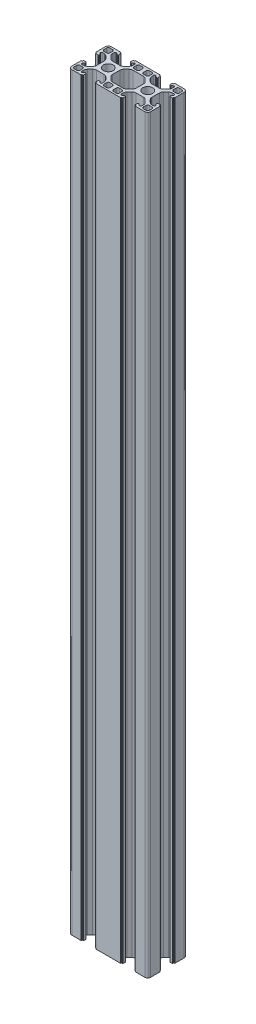
from build123d import *

# Parameters (mm, degrees)
EXTRUDE_1_DEPTH = 380


with BuildPart() as part:
    # Эскиз1 → Бобышка-Вытянуть1 (new body)
    with BuildSketch(Plane(origin=(0, 0, 0), x_dir=(1, 0, 0), z_dir=(0, 1, 0))):
        with BuildLine():
            Line((9.247825015, 4.683728486), (11.146605684, 4.683728486))
            ThreePointArc((11.146605684, 4.683728486), (11.911972549, 4.835969421), (12.560819246, 5.269514923))
            Line((12.560819246, 5.269514923), (13.862038577, 6.570734254))
            ThreePointArc((13.862038577, 6.570734254), (14.29558408, 7.219580952), (14.447825015, 7.984947817))
            Line((14.447825015, 7.984947817), (14.447825015, 8.883728486))
            ThreePointArc((14.447825015, 8.883728486), (14.301378405, 9.237281876), (13.947825015, 9.383728486))
            Line((13.947825015, 9.383728486), (13.844931796, 9.383728486))
            ThreePointArc((13.844931796, 9.383728486), (13.65359008, 9.345668252), (13.491378405, 9.237281876))
            Line((13.491378405, 9.237281876), (13.01104832, 8.75695179))
            ThreePointArc((13.01104832, 8.75695179), (12.929942482, 8.702758603), (12.834271624, 8.683728486))
            Line((12.834271624, 8.683728486), (12.547825015, 8.683728486))
            ThreePointArc((12.547825015, 8.683728486), (12.37104832, 8.75695179), (12.297825015, 8.933728486))
            Line((12.297825015, 8.933728486), (12.297825015, 10.082799306))
            ThreePointArc((12.297825015, 10.082799306), (12.341758998, 10.188865323), (12.447825015, 10.232799306))
            Line((12.447825015, 10.232799306), (12.947825015, 10.232799306))
            Line((12.947825015, 10.232799306), (12.947825015, 10.533728486))
            ThreePointArc((12.947825015, 10.533728486), (12.991758998, 10.639794503), (13.097825015, 10.683728486))
            Line((13.097825015, 10.683728486), (17.747825015, 10.683728486))
            ThreePointArc((17.747825015, 10.683728486), (18.808485187, 10.244388658), (19.247825015, 9.183728486))
            Line((19.247825015, 9.183728486), (19.247825015, 4.533728486))
            ThreePointArc((19.247825015, 4.533728486), (19.203891032, 4.427662469), (19.097825015, 4.383728486))
            Line((19.097825015, 4.383728486), (18.796895835, 4.383728486))
            Line((18.796895835, 4.383728486), (18.796895835, 3.883728486))
            ThreePointArc((18.796895835, 3.883728486), (18.752961853, 3.777662469), (18.646895835, 3.733728486))
            Line((18.646895835, 3.733728486), (17.497825015, 3.733728486))
            ThreePointArc((17.497825015, 3.733728486), (17.32104832, 3.80695179), (17.247825015, 3.983728486))
            Line((17.247825015, 3.983728486), (17.247825015, 4.270175095))
            ThreePointArc((17.247825015, 4.270175095), (17.266855132, 4.365845953), (17.32104832, 4.44695179))
            Line((17.32104832, 4.44695179), (17.801378405, 4.927281876))
            ThreePointArc((17.801378405, 4.927281876), (17.909764781, 5.089493551), (17.947825015, 5.280835267))
            Line((17.947825015, 5.280835267), (17.947825015, 5.383728486))
            ThreePointArc((17.947825015, 5.383728486), (17.801378405, 5.737281876), (17.447825015, 5.883728486))
            Line((17.447825015, 5.883728486), (16.549044346, 5.883728486))
            ThreePointArc((16.549044346, 5.883728486), (15.783677481, 5.731487551), (15.134830783, 5.297942048))
            Line((15.134830783, 5.297942048), (13.833611452, 3.996722717))
            ThreePointArc((13.833611452, 3.996722717), (13.40006595, 3.34787602), (13.247825015, 2.582509155))
            Line((13.247825015, 2.582509155), (13.247825015, 0.683728486))
            Line((13.247825015, 0.683728486), (13.247825015, -1.215052183))
            ThreePointArc((13.247825015, -1.215052183), (13.40006595, -1.980419048), (13.833611452, -2.629265746))
            Line((13.833611452, -2.629265746), (15.134830783, -3.930485077))
            ThreePointArc((15.134830783, -3.930485077), (15.783677481, -4.364030579), (16.549044346, -4.516271514))
            Line((16.549044346, -4.516271514), (17.447825015, -4.516271514))
            ThreePointArc((17.447825015, -4.516271514), (17.801378405, -4.369824905), (17.947825015, -4.016271514))
            Line((17.947825015, -4.016271514), (17.947825015, -3.913378295))
            ThreePointArc((17.947825015, -3.913378295), (17.909764781, -3.722036579), (17.801378405, -3.559824905))
            Line((17.801378405, -3.559824905), (17.32104832, -3.079494819))
            ThreePointArc((17.32104832, -3.079494819), (17.266855132, -2.998388982), (17.247825015, -2.902718124))
            Line((17.247825015, -2.902718124), (17.247825015, -2.616271514))
            ThreePointArc((17.247825015, -2.616271514), (17.32104832, -2.439494819), (17.497825015, -2.366271514))
            Line((17.497825015, -2.366271514), (18.646895835, -2.366271514))
            ThreePointArc((18.646895835, -2.366271514), (18.752961853, -2.410205497), (18.796895835, -2.516271514))
            Line((18.796895835, -2.516271514), (18.796895835, -3.016271514))
            Line((18.796895835, -3.016271514), (19.097825015, -3.016271514))
            ThreePointArc((19.097825015, -3.016271514), (19.203891032, -3.060205497), (19.247825015, -3.166271514))
            Line((19.247825015, -3.166271514), (19.247825015, -7.816271514))
            ThreePointArc((19.247825015, -7.816271514), (18.808485187, -8.876931686), (17.747825015, -9.316271514))
            Line((17.747825015, -9.316271514), (13.097825015, -9.316271514))
            ThreePointArc((13.097825015, -9.316271514), (12.991758998, -9.272337531), (12.947825015, -9.166271514))
            Line((12.947825015, -9.166271514), (12.947825015, -8.865342335))
            Line((12.947825015, -8.865342335), (12.447825015, -8.865342335))
            ThreePointArc((12.447825015, -8.865342335), (12.341758998, -8.821408352), (12.297825015, -8.715342335))
            Line((12.297825015, -8.715342335), (12.297825015, -7.566271514))
            ThreePointArc((12.297825015, -7.566271514), (12.37104832, -7.389494819), (12.547825015, -7.316271514))
            Line((12.547825015, -7.316271514), (12.834271624, -7.316271514))
            ThreePointArc((12.834271624, -7.316271514), (12.929942482, -7.335301631), (13.01104832, -7.389494819))
            Line((13.01104832, -7.389494819), (13.491378405, -7.869824905))
            ThreePointArc((13.491378405, -7.869824905), (13.65359008, -7.978211281), (13.844931796, -8.016271514))
            Line((13.844931796, -8.016271514), (13.947825015, -8.016271514))
            ThreePointArc((13.947825015, -8.016271514), (14.301378405, -7.869824905), (14.447825015, -7.516271514))
            Line((14.447825015, -7.516271514), (14.447825015, -6.617490845))
            ThreePointArc((14.447825015, -6.617490845), (14.29558408, -5.85212398), (13.862038577, -5.203277283))
            Line((13.862038577, -5.203277283), (12.560819246, -3.902057952))
            ThreePointArc((12.560819246, -3.902057952), (11.911972549, -3.468512449), (11.146605684, -3.316271514))
            Line((11.146605684, -3.316271514), (9.247825015, -3.316271514))
            Line((9.247825015, -3.316271514), (7.349044346, -3.316271514))
            ThreePointArc((7.349044346, -3.316271514), (6.583677481, -3.468512449), (5.934830783, -3.902057952))
            Line((5.934830783, -3.902057952), (4.633611452, -5.203277283))
            ThreePointArc((4.633611452, -5.203277283), (4.20006595, -5.85212398), (4.047825015, -6.617490845))
            Line((4.047825015, -6.617490845), (4.047825015, -7.516271514))
            ThreePointArc((4.047825015, -7.516271514), (4.194271624, -7.869824905), (4.547825015, -8.016271514))
            Line((4.547825015, -8.016271514), (4.650718234, -8.016271514))
            ThreePointArc((4.650718234, -8.016271514), (4.84205995, -7.978211281), (5.004271624, -7.869824905))
            Line((5.004271624, -7.869824905), (5.48460171, -7.389494819))
            ThreePointArc((5.48460171, -7.389494819), (5.565707547, -7.335301631), (5.661378405, -7.316271514))
            Line((5.661378405, -7.316271514), (5.947825015, -7.316271514))
            ThreePointArc((5.947825015, -7.316271514), (6.12460171, -7.389494819), (6.197825015, -7.566271514))
            Line((6.197825015, -7.566271514), (6.197825015, -8.715342335))
            ThreePointArc((6.197825015, -8.715342335), (6.153891032, -8.821408352), (6.047825015, -8.865342335))
            Line((6.047825015, -8.865342335), (5.547825015, -8.865342335))
            Line((5.547825015, -8.865342335), (5.547825015, -9.166271514))
            ThreePointArc((5.547825015, -9.166271514), (5.503891032, -9.272337531), (5.397825015, -9.316271514))
            Line((5.397825015, -9.316271514), (0.747825015, -9.316271514))
            Line((0.747825015, -9.316271514), (-2.252174985, -9.316271514))
            Line((-2.252174985, -9.316271514), (-6.902174985, -9.316271514))
            ThreePointArc((-6.902174985, -9.316271514), (-7.008241002, -9.272337531), (-7.052174985, -9.166271514))
            Line((-7.052174985, -9.166271514), (-7.052174985, -8.865342335))
            Line((-7.052174985, -8.865342335), (-7.552174985, -8.865342335))
            ThreePointArc((-7.552174985, -8.865342335), (-7.658241002, -8.821408352), (-7.702174985, -8.715342335))
            Line((-7.702174985, -8.715342335), (-7.702174985, -7.566271514))
            ThreePointArc((-7.702174985, -7.566271514), (-7.62895168, -7.389494819), (-7.452174985, -7.316271514))
            Line((-7.452174985, -7.316271514), (-7.165728376, -7.316271514))
            ThreePointArc((-7.165728376, -7.316271514), (-7.070057518, -7.335301631), (-6.98895168, -7.389494819))
            Line((-6.98895168, -7.389494819), (-6.508621595, -7.869824905))
            ThreePointArc((-6.508621595, -7.869824905), (-6.34640992, -7.978211281), (-6.155068204, -8.016271514))
            Line((-6.155068204, -8.016271514), (-6.052174985, -8.016271514))
            ThreePointArc((-6.052174985, -8.016271514), (-5.698621595, -7.869824905), (-5.552174985, -7.516271514))
            Line((-5.552174985, -7.516271514), (-5.552174985, -6.617490845))
            ThreePointArc((-5.552174985, -6.617490845), (-5.70441592, -5.85212398), (-6.137961423, -5.203277283))
            Line((-6.137961423, -5.203277283), (-7.439180754, -3.902057952))
            ThreePointArc((-7.439180754, -3.902057952), (-8.088027451, -3.468512449), (-8.853394316, -3.316271514))
            Line((-8.853394316, -3.316271514), (-10.752174985, -3.316271514))
            Line((-10.752174985, -3.316271514), (-12.650955654, -3.316271514))
            ThreePointArc((-12.650955654, -3.316271514), (-13.416322519, -3.468512449), (-14.065169217, -3.902057952))
            Line((-14.065169217, -3.902057952), (-15.366388548, -5.203277283))
            ThreePointArc((-15.366388548, -5.203277283), (-15.79993405, -5.85212398), (-15.952174985, -6.617490845))
            Line((-15.952174985, -6.617490845), (-15.952174985, -7.516271514))
            ThreePointArc((-15.952174985, -7.516271514), (-15.805728376, -7.869824905), (-15.452174985, -8.016271514))
            Line((-15.452174985, -8.016271514), (-15.349281766, -8.016271514))
            ThreePointArc((-15.349281766, -8.016271514), (-15.15794005, -7.978211281), (-14.995728376, -7.869824905))
            Line((-14.995728376, -7.869824905), (-14.51539829, -7.389494819))
            ThreePointArc((-14.51539829, -7.389494819), (-14.434292453, -7.335301631), (-14.338621595, -7.316271514))
            Line((-14.338621595, -7.316271514), (-14.052174985, -7.316271514))
            ThreePointArc((-14.052174985, -7.316271514), (-13.87539829, -7.389494819), (-13.802174985, -7.566271514))
            Line((-13.802174985, -7.566271514), (-13.802174985, -8.715342335))
            ThreePointArc((-13.802174985, -8.715342335), (-13.846108968, -8.821408352), (-13.952174985, -8.865342335))
            Line((-13.952174985, -8.865342335), (-14.452174985, -8.865342335))
            Line((-14.452174985, -8.865342335), (-14.452174985, -9.166271514))
            ThreePointArc((-14.452174985, -9.166271514), (-14.496108968, -9.272337531), (-14.602174985, -9.316271514))
            Line((-14.602174985, -9.316271514), (-19.252174985, -9.316271514))
            ThreePointArc((-19.252174985, -9.316271514), (-20.312835157, -8.876931686), (-20.752174985, -7.816271514))
            Line((-20.752174985, -7.816271514), (-20.752174985, -3.166271514))
            ThreePointArc((-20.752174985, -3.166271514), (-20.708241002, -3.060205497), (-20.602174985, -3.016271514))
            Line((-20.602174985, -3.016271514), (-20.301245806, -3.016271514))
            Line((-20.301245806, -3.016271514), (-20.301245806, -2.516271514))
            ThreePointArc((-20.301245806, -2.516271514), (-20.257311823, -2.410205497), (-20.151245806, -2.366271514))
            Line((-20.151245806, -2.366271514), (-19.002174985, -2.366271514))
            ThreePointArc((-19.002174985, -2.366271514), (-18.82539829, -2.439494819), (-18.752174985, -2.616271514))
            Line((-18.752174985, -2.616271514), (-18.752174985, -2.902718124))
            ThreePointArc((-18.752174985, -2.902718124), (-18.771205102, -2.998388982), (-18.82539829, -3.079494819))
            Line((-18.82539829, -3.079494819), (-19.305728376, -3.559824905))
            ThreePointArc((-19.305728376, -3.559824905), (-19.414114751, -3.722036579), (-19.452174985, -3.913378295))
            Line((-19.452174985, -3.913378295), (-19.452174985, -4.016271514))
            ThreePointArc((-19.452174985, -4.016271514), (-19.305728376, -4.369824905), (-18.952174985, -4.516271514))
            Line((-18.952174985, -4.516271514), (-18.053394316, -4.516271514))
            ThreePointArc((-18.053394316, -4.516271514), (-17.288027451, -4.364030579), (-16.639180754, -3.930485077))
            Line((-16.639180754, -3.930485077), (-15.337961423, -2.629265746))
            ThreePointArc((-15.337961423, -2.629265746), (-14.90441592, -1.980419048), (-14.752174985, -1.215052183))
            Line((-14.752174985, -1.215052183), (-14.752174985, 0.683728486))
            Line((-14.752174985, 0.683728486), (-14.752174985, 2.582509155))
            ThreePointArc((-14.752174985, 2.582509155), (-14.90441592, 3.34787602), (-15.337961423, 3.996722717))
            Line((-15.337961423, 3.996722717), (-16.639180754, 5.297942048))
            ThreePointArc((-16.639180754, 5.297942048), (-17.288027451, 5.731487551), (-18.053394316, 5.883728486))
            Line((-18.053394316, 5.883728486), (-18.952174985, 5.883728486))
            ThreePointArc((-18.952174985, 5.883728486), (-19.305728376, 5.737281876), (-19.452174985, 5.383728486))
            Line((-19.452174985, 5.383728486), (-19.452174985, 5.280835267))
            ThreePointArc((-19.452174985, 5.280835267), (-19.414114751, 5.089493551), (-19.305728376, 4.927281876))
            Line((-19.305728376, 4.927281876), (-18.82539829, 4.44695179))
            ThreePointArc((-18.82539829, 4.44695179), (-18.771205102, 4.365845953), (-18.752174985, 4.270175095))
            Line((-18.752174985, 4.270175095), (-18.752174985, 3.983728486))
            ThreePointArc((-18.752174985, 3.983728486), (-18.82539829, 3.80695179), (-19.002174985, 3.733728486))
            Line((-19.002174985, 3.733728486), (-20.151245806, 3.733728486))
            ThreePointArc((-20.151245806, 3.733728486), (-20.257311823, 3.777662469), (-20.301245806, 3.883728486))
            Line((-20.301245806, 3.883728486), (-20.301245806, 4.383728486))
            Line((-20.301245806, 4.383728486), (-20.602174985, 4.383728486))
            ThreePointArc((-20.602174985, 4.383728486), (-20.708241002, 4.427662469), (-20.752174985, 4.533728486))
            Line((-20.752174985, 4.533728486), (-20.752174985, 9.183728486))
            ThreePointArc((-20.752174985, 9.183728486), (-20.312835157, 10.244388658), (-19.252174985, 10.683728486))
            Line((-19.252174985, 10.683728486), (-14.602174985, 10.683728486))
            ThreePointArc((-14.602174985, 10.683728486), (-14.496108968, 10.639794503), (-14.452174985, 10.533728486))
            Line((-14.452174985, 10.533728486), (-14.452174985, 10.232799306))
            Line((-14.452174985, 10.232799306), (-13.952174985, 10.232799306))
            ThreePointArc((-13.952174985, 10.232799306), (-13.846108968, 10.188865323), (-13.802174985, 10.082799306))
            Line((-13.802174985, 10.082799306), (-13.802174985, 8.933728486))
            ThreePointArc((-13.802174985, 8.933728486), (-13.87539829, 8.75695179), (-14.052174985, 8.683728486))
            Line((-14.052174985, 8.683728486), (-14.338621595, 8.683728486))
            ThreePointArc((-14.338621595, 8.683728486), (-14.434292453, 8.702758603), (-14.51539829, 8.75695179))
            Line((-14.51539829, 8.75695179), (-14.995728376, 9.237281876))
            ThreePointArc((-14.995728376, 9.237281876), (-15.15794005, 9.345668252), (-15.349281766, 9.383728486))
            Line((-15.349281766, 9.383728486), (-15.452174985, 9.383728486))
            ThreePointArc((-15.452174985, 9.383728486), (-15.805728376, 9.237281876), (-15.952174985, 8.883728486))
            Line((-15.952174985, 8.883728486), (-15.952174985, 7.984947817))
            ThreePointArc((-15.952174985, 7.984947817), (-15.79993405, 7.219580952), (-15.366388548, 6.570734254))
            Line((-15.366388548, 6.570734254), (-14.065169217, 5.269514923))
            ThreePointArc((-14.065169217, 5.269514923), (-13.416322519, 4.835969421), (-12.650955654, 4.683728486))
            Line((-12.650955654, 4.683728486), (-10.752174985, 4.683728486))
            Line((-10.752174985, 4.683728486), (-8.853394316, 4.683728486))
            ThreePointArc((-8.853394316, 4.683728486), (-8.088027451, 4.835969421), (-7.439180754, 5.269514923))
            Line((-7.439180754, 5.269514923), (-6.137961423, 6.570734254))
            ThreePointArc((-6.137961423, 6.570734254), (-5.70441592, 7.219580952), (-5.552174985, 7.984947817))
            Line((-5.552174985, 7.984947817), (-5.552174985, 8.883728486))
            ThreePointArc((-5.552174985, 8.883728486), (-5.698621595, 9.237281876), (-6.052174985, 9.383728486))
            Line((-6.052174985, 9.383728486), (-6.155068204, 9.383728486))
            ThreePointArc((-6.155068204, 9.383728486), (-6.34640992, 9.345668252), (-6.508621595, 9.237281876))
            Line((-6.508621595, 9.237281876), (-6.98895168, 8.75695179))
            ThreePointArc((-6.98895168, 8.75695179), (-7.070057518, 8.702758603), (-7.165728376, 8.683728486))
            Line((-7.165728376, 8.683728486), (-7.452174985, 8.683728486))
            ThreePointArc((-7.452174985, 8.683728486), (-7.62895168, 8.75695179), (-7.702174985, 8.933728486))
            Line((-7.702174985, 8.933728486), (-7.702174985, 10.082799306))
            ThreePointArc((-7.702174985, 10.082799306), (-7.658241002, 10.188865323), (-7.552174985, 10.232799306))
            Line((-7.552174985, 10.232799306), (-7.052174985, 10.232799306))
            Line((-7.052174985, 10.232799306), (-7.052174985, 10.533728486))
            ThreePointArc((-7.052174985, 10.533728486), (-7.008241002, 10.639794503), (-6.902174985, 10.683728486))
            Line((-6.902174985, 10.683728486), (-2.252174985, 10.683728486))
            Line((-2.252174985, 10.683728486), (0.747825015, 10.683728486))
            Line((0.747825015, 10.683728486), (5.397825015, 10.683728486))
            ThreePointArc((5.397825015, 10.683728486), (5.503891032, 10.639794503), (5.547825015, 10.533728486))
            Line((5.547825015, 10.533728486), (5.547825015, 10.232799306))
            Line((5.547825015, 10.232799306), (6.047825015, 10.232799306))
            ThreePointArc((6.047825015, 10.232799306), (6.153891032, 10.188865323), (6.197825015, 10.082799306))
            Line((6.197825015, 10.082799306), (6.197825015, 8.933728486))
            ThreePointArc((6.197825015, 8.933728486), (6.12460171, 8.75695179), (5.947825015, 8.683728486))
            Line((5.947825015, 8.683728486), (5.661378405, 8.683728486))
            ThreePointArc((5.661378405, 8.683728486), (5.565707547, 8.702758603), (5.48460171, 8.75695179))
            Line((5.48460171, 8.75695179), (5.004271624, 9.237281876))
            ThreePointArc((5.004271624, 9.237281876), (4.84205995, 9.345668252), (4.650718234, 9.383728486))
            Line((4.650718234, 9.383728486), (4.547825015, 9.383728486))
            ThreePointArc((4.547825015, 9.383728486), (4.194271624, 9.237281876), (4.047825015, 8.883728486))
            Line((4.047825015, 8.883728486), (4.047825015, 7.984947817))
            ThreePointArc((4.047825015, 7.984947817), (4.20006595, 7.219580952), (4.633611452, 6.570734254))
            Line((4.633611452, 6.570734254), (5.934830783, 5.269514923))
            ThreePointArc((5.934830783, 5.269514923), (6.583677481, 4.835969421), (7.349044346, 4.683728486))
            Line((7.349044346, 4.683728486), (9.247825015, 4.683728486))
        make_face()
        with BuildLine():
            Line((16.147825015, 6.783728486), (17.547825015, 6.783728486))
            ThreePointArc((17.547825015, 6.783728486), (18.11351044, 7.018043061), (18.347825015, 7.583728486))
            Line((18.347825015, 7.583728486), (18.347825015, 8.983728486))
            ThreePointArc((18.347825015, 8.983728486), (18.11351044, 9.549413911), (17.547825015, 9.783728486))
            Line((17.547825015, 9.783728486), (16.147825015, 9.783728486))
            ThreePointArc((16.147825015, 9.783728486), (15.58213959, 9.549413911), (15.347825015, 8.983728486))
            Line((15.347825015, 8.983728486), (15.347825015, 7.583728486))
            ThreePointArc((15.347825015, 7.583728486), (15.58213959, 7.018043061), (16.147825015, 6.783728486))
        make_face(mode=Mode.SUBTRACT)
        with BuildLine():
            Line((15.347825015, -6.216271514), (15.347825015, -7.616271514))
            ThreePointArc((15.347825015, -7.616271514), (15.58213959, -8.181956939), (16.147825015, -8.416271514))
            Line((16.147825015, -8.416271514), (17.547825015, -8.416271514))
            ThreePointArc((17.547825015, -8.416271514), (18.11351044, -8.181956939), (18.347825015, -7.616271514))
            Line((18.347825015, -7.616271514), (18.347825015, -6.216271514))
            ThreePointArc((18.347825015, -6.216271514), (18.11351044, -5.650586089), (17.547825015, -5.416271514))
            Line((17.547825015, -5.416271514), (16.147825015, -5.416271514))
            ThreePointArc((16.147825015, -5.416271514), (15.58213959, -5.650586089), (15.347825015, -6.216271514))
        make_face(mode=Mode.SUBTRACT)
        with BuildLine():
            Line((2.347825015, -5.416271514), (0.947825015, -5.416271514))
            ThreePointArc((0.947825015, -5.416271514), (0.38213959, -5.650586089), (0.147825015, -6.216271514))
            Line((0.147825015, -6.216271514), (0.147825015, -7.616271514))
            ThreePointArc((0.147825015, -7.616271514), (0.38213959, -8.181956939), (0.947825015, -8.416271514))
            Line((0.947825015, -8.416271514), (2.347825015, -8.416271514))
            ThreePointArc((2.347825015, -8.416271514), (2.91351044, -8.181956939), (3.147825015, -7.616271514))
            Line((3.147825015, -7.616271514), (3.147825015, -6.216271514))
            ThreePointArc((3.147825015, -6.216271514), (2.91351044, -5.650586089), (2.347825015, -5.416271514))
        make_face(mode=Mode.SUBTRACT)
        with BuildLine():
            Line((1.047825015, -4.516271514), (1.946605684, -4.516271514))
            ThreePointArc((1.946605684, -4.516271514), (2.711972549, -4.364030579), (3.360819246, -3.930485077))
            Line((3.360819246, -3.930485077), (4.662038577, -2.629265746))
            ThreePointArc((4.662038577, -2.629265746), (5.09558408, -1.980419048), (5.247825015, -1.215052183))
            Line((5.247825015, -1.215052183), (5.247825015, 0.683728486))
            Line((5.247825015, 0.683728486), (5.247825015, 2.582509155))
            ThreePointArc((5.247825015, 2.582509155), (5.09558408, 3.34787602), (4.662038577, 3.996722717))
            Line((4.662038577, 3.996722717), (3.360819246, 5.297942048))
            ThreePointArc((3.360819246, 5.297942048), (2.711972549, 5.731487551), (1.946605684, 5.883728486))
            Line((1.946605684, 5.883728486), (1.047825015, 5.883728486))
            Line((1.047825015, 5.883728486), (-2.552174985, 5.883728486))
            Line((-2.552174985, 5.883728486), (-3.450955654, 5.883728486))
            ThreePointArc((-3.450955654, 5.883728486), (-4.216322519, 5.731487551), (-4.865169217, 5.297942048))
            Line((-4.865169217, 5.297942048), (-6.166388548, 3.996722717))
            ThreePointArc((-6.166388548, 3.996722717), (-6.59993405, 3.34787602), (-6.752174985, 2.582509155))
            Line((-6.752174985, 2.582509155), (-6.752174985, 0.683728486))
            Line((-6.752174985, 0.683728486), (-6.752174985, -1.215052183))
            ThreePointArc((-6.752174985, -1.215052183), (-6.59993405, -1.980419048), (-6.166388548, -2.629265746))
            Line((-6.166388548, -2.629265746), (-4.865169217, -3.930485077))
            ThreePointArc((-4.865169217, -3.930485077), (-4.216322519, -4.364030579), (-3.450955654, -4.516271514))
            Line((-3.450955654, -4.516271514), (-2.552174985, -4.516271514))
            Line((-2.552174985, -4.516271514), (1.047825015, -4.516271514))
        make_face(mode=Mode.SUBTRACT)
        with BuildLine():
            Line((3.147825015, 7.583728486), (3.147825015, 8.983728486))
            ThreePointArc((3.147825015, 8.983728486), (2.91351044, 9.549413911), (2.347825015, 9.783728486))
            Line((2.347825015, 9.783728486), (0.947825015, 9.783728486))
            ThreePointArc((0.947825015, 9.783728486), (0.38213959, 9.549413911), (0.147825015, 8.983728486))
            Line((0.147825015, 8.983728486), (0.147825015, 7.583728486))
            ThreePointArc((0.147825015, 7.583728486), (0.38213959, 7.018043061), (0.947825015, 6.783728486))
            Line((0.947825015, 6.783728486), (2.347825015, 6.783728486))
            ThreePointArc((2.347825015, 6.783728486), (2.91351044, 7.018043061), (3.147825015, 7.583728486))
        make_face(mode=Mode.SUBTRACT)
        with BuildLine():
            Line((-2.452174985, 9.783728486), (-3.852174985, 9.783728486))
            ThreePointArc((-3.852174985, 9.783728486), (-4.41786041, 9.549413911), (-4.652174985, 8.983728486))
            Line((-4.652174985, 8.983728486), (-4.652174985, 7.583728486))
            ThreePointArc((-4.652174985, 7.583728486), (-4.41786041, 7.018043061), (-3.852174985, 6.783728486))
            Line((-3.852174985, 6.783728486), (-2.452174985, 6.783728486))
            ThreePointArc((-2.452174985, 6.783728486), (-1.88648956, 7.018043061), (-1.652174985, 7.583728486))
            Line((-1.652174985, 7.583728486), (-1.652174985, 8.983728486))
            ThreePointArc((-1.652174985, 8.983728486), (-1.88648956, 9.549413911), (-2.452174985, 9.783728486))
        make_face(mode=Mode.SUBTRACT)
        with BuildLine():
            Line((-1.652174985, -7.616271514), (-1.652174985, -6.216271514))
            ThreePointArc((-1.652174985, -6.216271514), (-1.88648956, -5.650586089), (-2.452174985, -5.416271514))
            Line((-2.452174985, -5.416271514), (-3.852174985, -5.416271514))
            ThreePointArc((-3.852174985, -5.416271514), (-4.41786041, -5.650586089), (-4.652174985, -6.216271514))
            Line((-4.652174985, -6.216271514), (-4.652174985, -7.616271514))
            ThreePointArc((-4.652174985, -7.616271514), (-4.41786041, -8.181956939), (-3.852174985, -8.416271514))
            Line((-3.852174985, -8.416271514), (-2.452174985, -8.416271514))
            ThreePointArc((-2.452174985, -8.416271514), (-1.88648956, -8.181956939), (-1.652174985, -7.616271514))
        make_face(mode=Mode.SUBTRACT)
        with BuildLine():
            Line((-19.052174985, -8.416271514), (-17.652174985, -8.416271514))
            ThreePointArc((-17.652174985, -8.416271514), (-17.08648956, -8.181956939), (-16.852174985, -7.616271514))
            Line((-16.852174985, -7.616271514), (-16.852174985, -6.216271514))
            ThreePointArc((-16.852174985, -6.216271514), (-17.08648956, -5.650586089), (-17.652174985, -5.416271514))
            Line((-17.652174985, -5.416271514), (-19.052174985, -5.416271514))
            ThreePointArc((-19.052174985, -5.416271514), (-19.61786041, -5.650586089), (-19.852174985, -6.216271514))
            Line((-19.852174985, -6.216271514), (-19.852174985, -7.616271514))
            ThreePointArc((-19.852174985, -7.616271514), (-19.61786041, -8.181956939), (-19.052174985, -8.416271514))
        make_face(mode=Mode.SUBTRACT)
        with BuildLine():
            Line((-19.852174985, 8.983728486), (-19.852174985, 7.583728486))
            ThreePointArc((-19.852174985, 7.583728486), (-19.61786041, 7.018043061), (-19.052174985, 6.783728486))
            Line((-19.052174985, 6.783728486), (-17.652174985, 6.783728486))
            ThreePointArc((-17.652174985, 6.783728486), (-17.08648956, 7.018043061), (-16.852174985, 7.583728486))
            Line((-16.852174985, 7.583728486), (-16.852174985, 8.983728486))
            ThreePointArc((-16.852174985, 8.983728486), (-17.08648956, 9.549413911), (-17.652174985, 9.783728486))
            Line((-17.652174985, 9.783728486), (-19.052174985, 9.783728486))
            ThreePointArc((-19.052174985, 9.783728486), (-19.61786041, 9.549413911), (-19.852174985, 8.983728486))
        make_face(mode=Mode.SUBTRACT)
        with BuildLine():
            ThreePointArc((11.747825015, 0.683728486), (11.015591968, 2.451495439), (9.247825015, 3.183728486))
            ThreePointArc((9.247825015, 3.183728486), (7.480058062, 2.451495439), (6.747825015, 0.683728486))
            ThreePointArc((6.747825015, 0.683728486), (7.480058062, -1.084038467), (9.247825015, -1.816271514))
            ThreePointArc((9.247825015, -1.816271514), (11.015591968, -1.084038467), (11.747825015, 0.683728486))
        make_face(mode=Mode.SUBTRACT)
        with BuildLine():
            ThreePointArc((-10.752174985, 3.183728486), (-8.984408032, 2.451495439), (-8.252174985, 0.683728486))
            ThreePointArc((-8.252174985, 0.683728486), (-8.984408032, -1.084038467), (-10.752174985, -1.816271514))
            ThreePointArc((-10.752174985, -1.816271514), (-12.519941938, -1.084038467), (-13.252174985, 0.683728486))
            ThreePointArc((-13.252174985, 0.683728486), (-12.519941938, 2.451495439), (-10.752174985, 3.183728486))
        make_face(mode=Mode.SUBTRACT)
    extrude(amount=EXTRUDE_1_DEPTH)


solid = part.part
